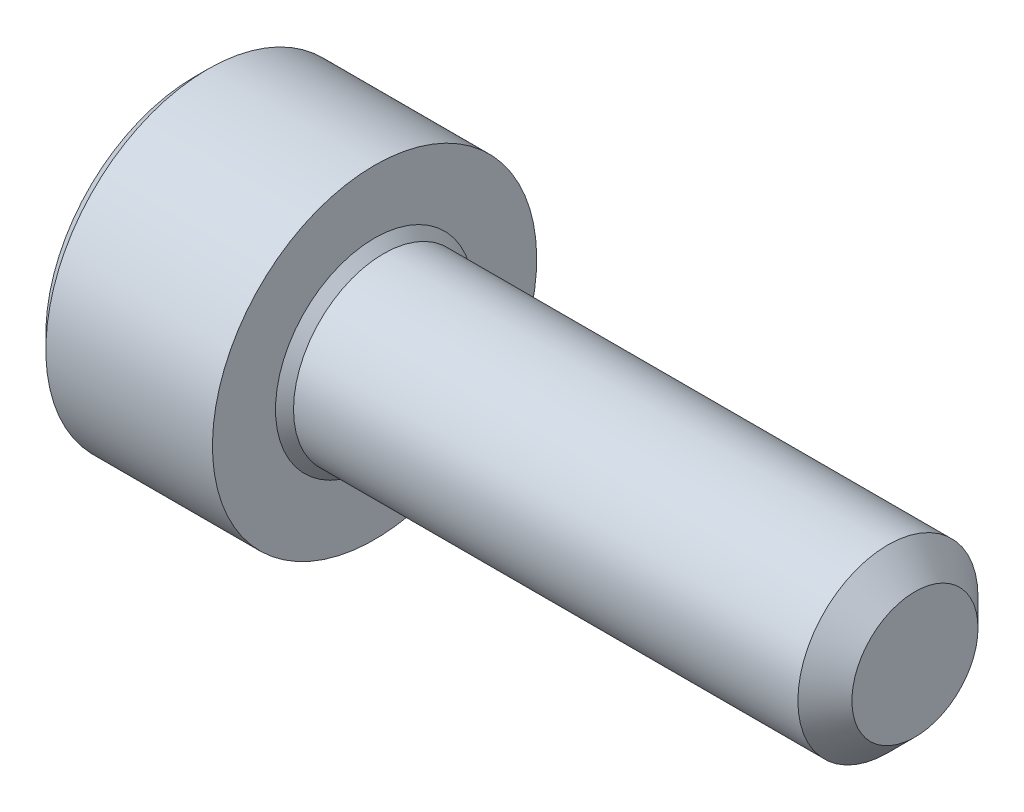
from build123d import *

# Parameters (mm, degrees)
SKETCH2_R           = 1
BOSS_EXTRUDE1_DEPTH = 6
CHAMFER1_SIZE       = 0.3
SKETCH6_W           = 2
SKETCH6_H           = 1.8
CUT_EXTRUDE1_DEPTH  = 1
CHAMFER2_SIZE       = 0.15
CHAMFER3_SIZE       = 0.1


with BuildPart() as part:
    # Sketch2 → Boss-Extrude1 (new body)
    with BuildSketch(Plane(origin=(0, 0, 0), x_dir=(0, 0, -1), z_dir=(1, 0, 0))):
        Circle(SKETCH2_R)
    extrude(amount=-BOSS_EXTRUDE1_DEPTH)

    # Chamfer1
    chamfer1_edges = [part.edges().sort_by_distance(p)[0] for p in [
        (0, 0, 1),
    ]]
    chamfer(chamfer1_edges, length=CHAMFER1_SIZE)

    # Sketch6 → Revolve1 (revolve)
    with BuildSketch(Plane.XY):
        with Locations((-7, 0.9)):
            Rectangle(SKETCH6_W, SKETCH6_H)
    revolve(axis=Axis((-6, 0, 0), (-1, 0, 0)))

    # Sketch7 → Cut-Extrude1 (cut)
    with BuildSketch(Plane.ZY.offset(8)):
        Polygon((0, 0.894892917), (-0.775, 0.447446459), (-0.775, -0.447446459), (0, -0.894892917), (0.775, -0.447446459), (0.775, 0.447446459), align=None)
    extrude(amount=-CUT_EXTRUDE1_DEPTH, mode=Mode.SUBTRACT)

    # Cut-Extrude2 cone 1 section (through the dimple's axis) → Cut-Extrude2 (revolve, cut)
    with BuildSketch(Plane(origin=(-8, 0, 0), x_dir=(0, 0, 1), z_dir=(0, 1, 0))):
        Polygon((0, 0), (0.944892917, 0), (0, 0.944892917), align=None)
    revolve(axis=Axis((-8, 0, 0), (1, 0, 0)), mode=Mode.SUBTRACT)

    # Chamfer2
    chamfer2_edges = [part.edges().sort_by_distance(p)[0] for p in [
        (-8, -1.8, 0),
    ]]
    chamfer(chamfer2_edges, length=CHAMFER2_SIZE)

    # Chamfer3
    chamfer3_edges = [part.edges().sort_by_distance(p)[0] for p in [
        (-6, 0, 1),
    ]]
    chamfer(chamfer3_edges, length=CHAMFER3_SIZE)


solid = part.part
